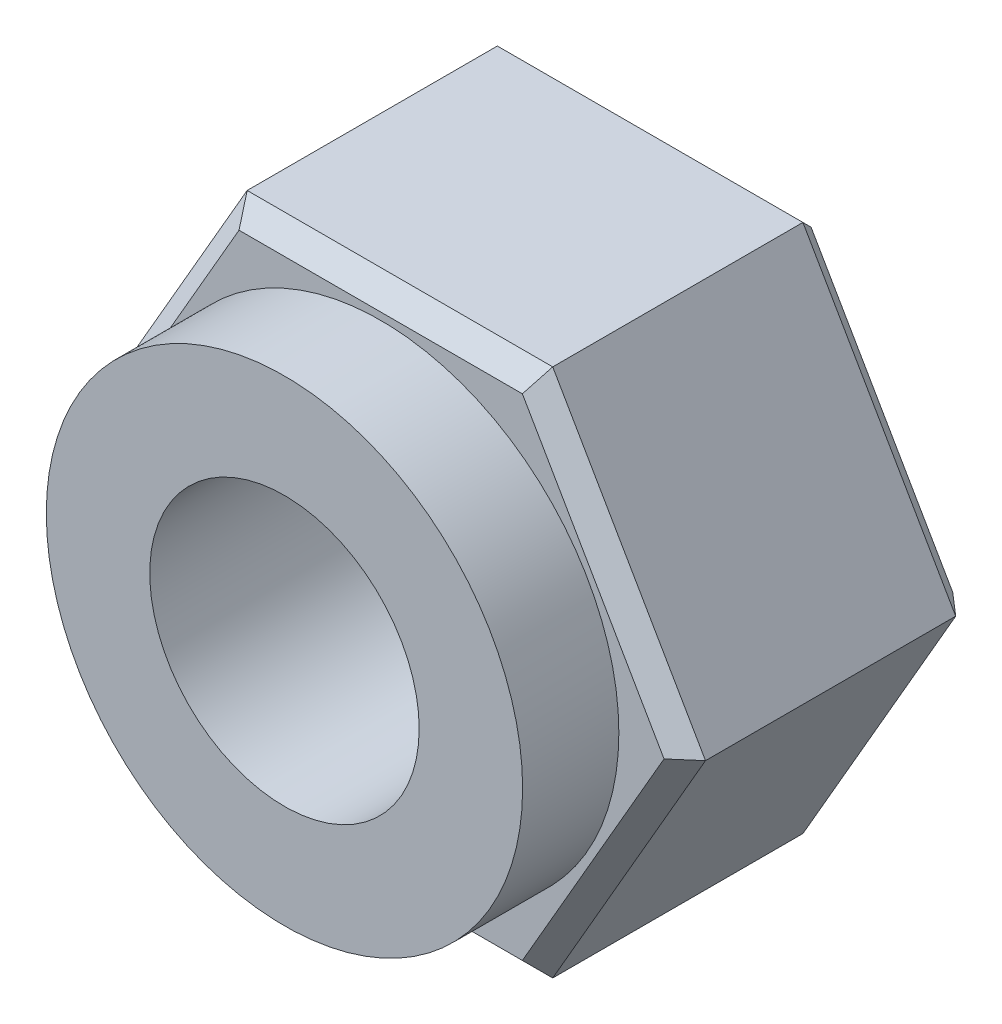
from build123d import *

# Parameters (mm, degrees)
NUT_HEX_EXTRUDE_DEPTH  = 3
HEX_EDGE_CHAMFERS_SIZE = 0.2
NYLON_COLLAR_SKETCH_R  = 2.475
NYLON_COLLAR_DEPTH     = 1
THREAD_BORE_SKETCH_R   = 1.4
THREAD_BORE_CUT_DEPTH  = 6.800502852


with BuildPart() as part:
    # Nut Hex Sketch → Nut Hex Extrude (new body)
    with BuildSketch(Plane.XY):
        Polygon((3.175426481, 0), (1.58771324, 2.75), (-1.58771324, 2.75), (-3.175426481, 0), (-1.58771324, -2.75), (1.58771324, -2.75), align=None)
    extrude(amount=NUT_HEX_EXTRUDE_DEPTH)

    # Hex Edge Chamfers
    hex_edge_chamfers_edges = [part.edges().sort_by_distance(p)[0] for p in [
        (0, 2.75, 3),
        (-2.38156986, 1.375, 3),
        (-2.38156986, -1.375, 3),
        (0, -2.75, 3),
        (2.38156986, -1.375, 3),
        (0, -2.75, 0),
        (-2.38156986, -1.375, 0),
        (-2.38156986, 1.375, 0),
        (0, 2.75, 0),
        (2.38156986, 1.375, 0),
        (2.38156986, -1.375, 0),
        (2.38156986, 1.375, 3),
    ]]
    chamfer(hex_edge_chamfers_edges, length=HEX_EDGE_CHAMFERS_SIZE)

    # Nylon Collar Sketch → Nylon Collar (add)
    with BuildSketch(Plane.XY.offset(3)):
        Circle(NYLON_COLLAR_SKETCH_R)
    extrude(amount=NYLON_COLLAR_DEPTH)

    # Thread Bore Sketch → Thread Bore Cut (cut, through all)
    with BuildSketch(Plane.XY):
        Circle(THREAD_BORE_SKETCH_R)
    extrude(amount=THREAD_BORE_CUT_DEPTH, mode=Mode.SUBTRACT)


solid = part.part
